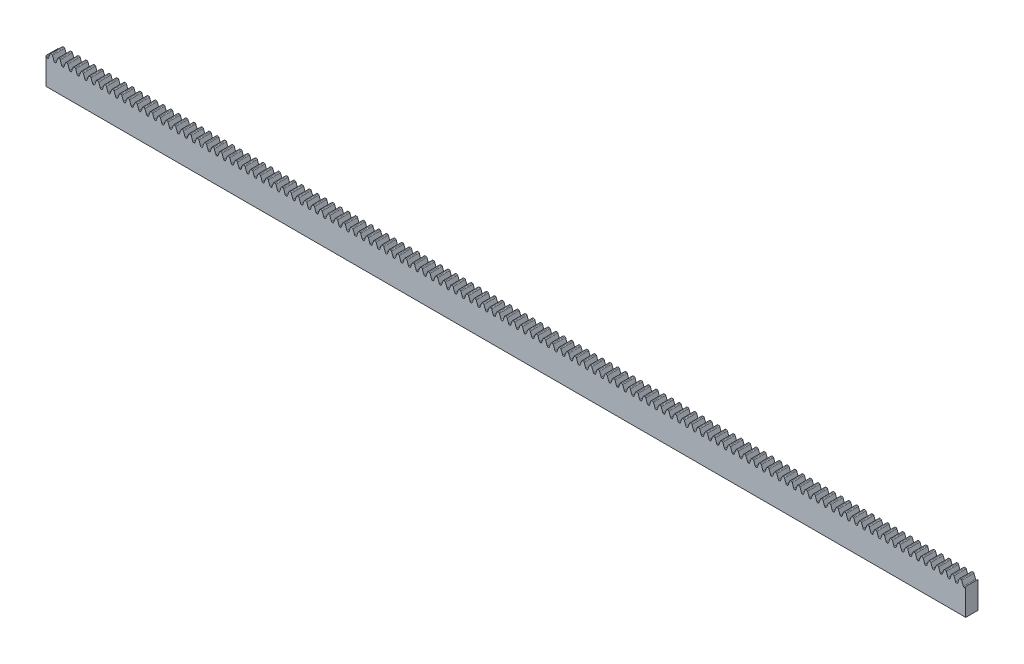
from build123d import *

# Parameters (mm, degrees)
BOSS_EXTRUDE1_DEPTH      = 2
BOSS_EXTRUDE1_DEPTH_BACK = 2
SKETCH3_W                = 300
SKETCH3_H                = 10
CUT_EXTRUDE1_DEPTH       = 151.096635539
LPATTERN1_COUNT          = 120
LPATTERN1_PITCH          = 2.513274123
LPATTERN1_COL_COUNT      = 2
LPATTERN1_COL_PITCH      = 2.513274123


with BuildPart() as part:
    # Sketch3 → Boss-Extrude1 (new, two sides: drawn at the far end of the back side and taken through both)
    with BuildSketch(Plane.XY.offset(-BOSS_EXTRUDE1_DEPTH_BACK)):
        Rectangle(SKETCH3_W, SKETCH3_H)
    extrude(amount=BOSS_EXTRUDE1_DEPTH + BOSS_EXTRUDE1_DEPTH_BACK)

    # Sketch4 → Cut-Extrude1 (cut, symmetric)
    with BuildSketch(Plane.XY):
        with BuildLine():
            Line((-148.684594354, 4.823395556), (-148.620315593, 5))
            Line((-148.620315593, 5), (-149.539810311, 5))
            Line((-149.539810311, 5), (-149.539810311, 3.2))
            Line((-149.539810311, 3.2), (-149.463400539, 3.2))
            ThreePointArc((-149.463400539, 3.2), (-149.309450312, 3.24854032), (-149.211183253, 3.376604444))
            Line((-149.211183253, 3.376604444), (-148.684594354, 4.823395556))
        make_face()
        with BuildLine():
            Line((-148.432377069, 5), (-148.620315593, 5))
            Line((-148.620315593, 5), (-148.684594354, 4.823395556))
            ThreePointArc((-148.684594354, 4.823395556), (-148.586327295, 4.95145968), (-148.432377069, 5))
        make_face()
        with BuildLine():
            Line((-147.881752145, 4.823395556), (-147.946030906, 5))
            Line((-147.946030906, 5), (-148.13396943, 5))
            ThreePointArc((-148.13396943, 5), (-147.980019204, 4.95145968), (-147.881752145, 4.823395556))
        make_face()
        with BuildLine():
            Line((-147.026536188, 3.2), (-147.026536188, 5))
            Line((-147.026536188, 5), (-147.946030906, 5))
            Line((-147.946030906, 5), (-147.881752145, 4.823395556))
            Line((-147.881752145, 4.823395556), (-147.355163245, 3.376604444))
            ThreePointArc((-147.355163245, 3.376604444), (-147.256896187, 3.24854032), (-147.10294596, 3.2))
            Line((-147.10294596, 3.2), (-147.026536188, 3.2))
        make_face()
    cut_extrude1 = extrude(amount=CUT_EXTRUDE1_DEPTH, both=True, mode=Mode.SUBTRACT)

    # LPattern1: Cut-Extrude1 ×120
    with Locations(*[(i * LPATTERN1_PITCH, 0, 0) for i in range(1, LPATTERN1_COUNT)]):
        add(cut_extrude1, mode=Mode.SUBTRACT)

    # LPattern1 col: Cut-Extrude1 ×2
    with Locations(*[(-i * LPATTERN1_COL_PITCH, 0, 0) for i in range(1, LPATTERN1_COL_COUNT)]):
        add(cut_extrude1, mode=Mode.SUBTRACT)


solid = part.part
